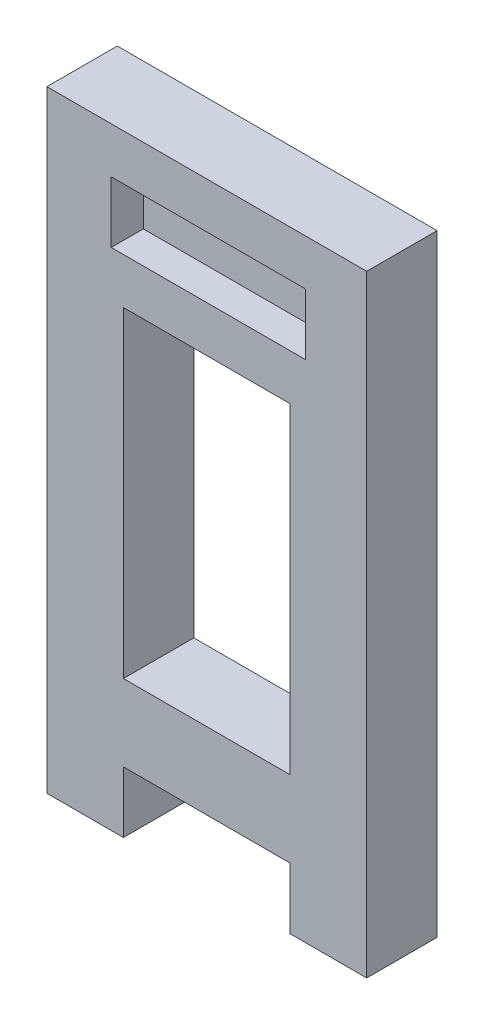
from build123d import *

# Parameters (mm, degrees)
SKETCH1_W           = 5.45
SKETCH1_H           = 10.5
SKETCH1_W_2         = 6.35
SKETCH1_H_2         = 2
BOSS_EXTRUDE1_DEPTH = 2.3
SKETCH1_2_W         = 6.35
SKETCH1_2_H         = 2
BOSS_EXTRUDE2_DEPTH = 1.25


with BuildPart() as part:
    # Sketch1 → Boss-Extrude1 (new body)
    with BuildSketch(Plane.XY):
        Polygon((0, 0), (0, -2), (2.5, -2), (2.5, 0), (7.95, 0), (7.95, -2), (10.45, -2), (10.45, 0), (10.45, 18), (0, 18), align=None)
        with Locations((5.225, 7.75)):
            Rectangle(SKETCH1_W, SKETCH1_H, mode=Mode.SUBTRACT)
        with Locations((5.275, 15.5)):
            Rectangle(SKETCH1_W_2, SKETCH1_H_2, mode=Mode.SUBTRACT)
    extrude(amount=BOSS_EXTRUDE1_DEPTH)

    # Sketch1<2> → Boss-Extrude2 (add)
    with BuildSketch(Plane.XY):
        with Locations((5.275, 15.5)):
            Rectangle(SKETCH1_2_W, SKETCH1_2_H)
    extrude(amount=BOSS_EXTRUDE2_DEPTH)


solid = part.part
